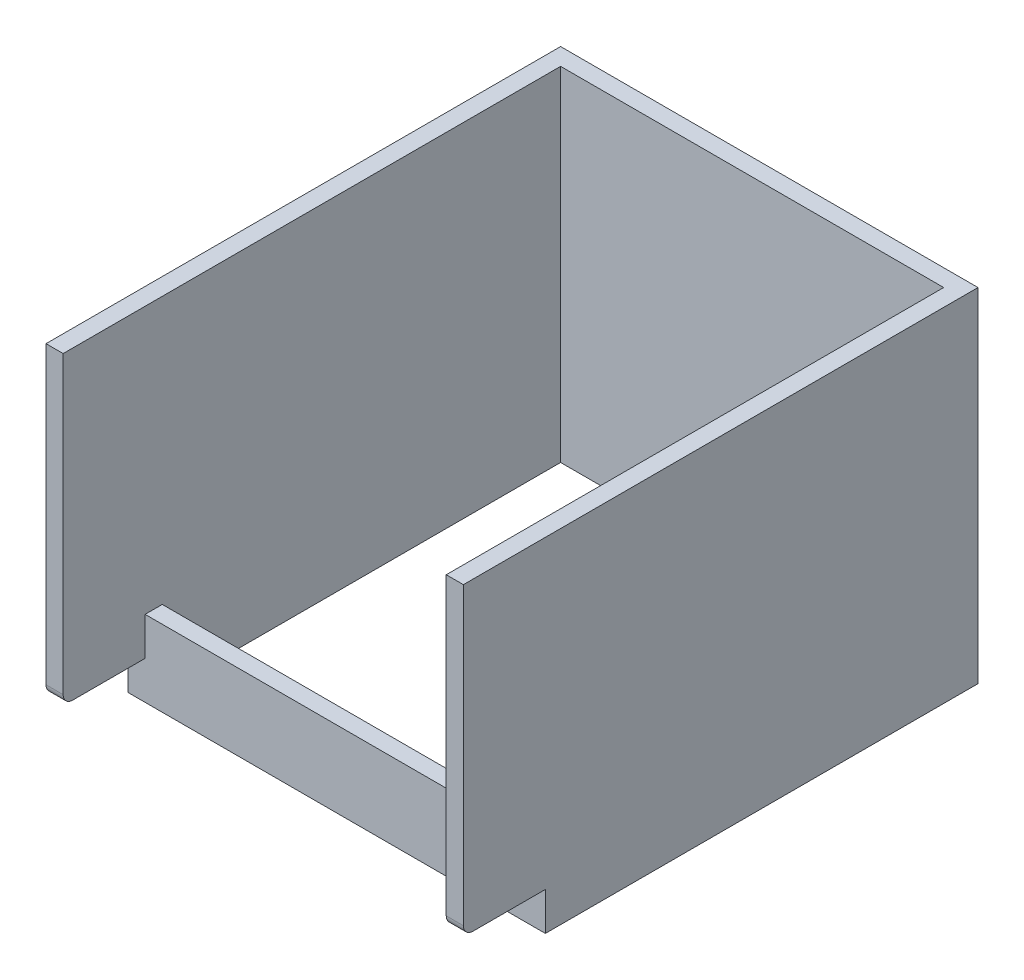
from build123d import *

# Parameters (mm, degrees)
SKETCH1_W               = 219
SKETCH1_H               = 250
BOSS_EXTRUDE1_DEPTH     = 3
EXTRUDE_THIN1_DEPTH     = 180
CUT_EXTRUDE2_DEPTH      = 256.764051422
CUT_EXTRUDE2_DEPTH_BACK = 256.764051422
SKETCH4_W               = 65.933085688
SKETCH4_H               = 20
SKETCH7_W               = 201
SKETCH7_H               = 9
BOSS_EXTRUDE3_DEPTH     = 40
FILLET7_R               = 5
SKETCH8_W               = 201
SKETCH8_H               = 209
CUT_EXTRUDE3_DEPTH      = 20


with BuildPart() as part:
    # Sketch1 → Boss-Extrude1 (new body)
    with BuildSketch(Plane(origin=(0, 0, 0), x_dir=(1, 0, 0), z_dir=(0, 1, 0))):
        Rectangle(SKETCH1_W, SKETCH1_H)
    extrude(amount=BOSS_EXTRUDE1_DEPTH)

    # Sketch2 → Extrude-Thin1 (add)
    with BuildSketch(Plane(origin=(0, 0, 0), x_dir=(1, 0, 0), z_dir=(0, 1, 0))):
        Polygon((-109.5, -145), (-109.5, -125), (-109.5, 125), (109.5, 125), (109.5, -125), (109.5, -145), (100.5, -145), (100.5, -125), (100.5, 116), (-100.5, 116), (-100.5, -125), (-100.5, -145), align=None)
    extrude(amount=EXTRUDE_THIN1_DEPTH)

    # Sketch4 → Cut-Extrude2 (cut, two sides: drawn at the far end of the back side and taken through both)
    with BuildSketch(Plane(origin=(0, 0, 0), x_dir=(0, 0, -1), z_dir=(1, 0, 0)).offset(-CUT_EXTRUDE2_DEPTH_BACK)):
        with Locations((-134.966542844, 10)):
            Rectangle(SKETCH4_W, SKETCH4_H)
    extrude(amount=CUT_EXTRUDE2_DEPTH + CUT_EXTRUDE2_DEPTH_BACK, mode=Mode.SUBTRACT)

    # Sketch7 → Boss-Extrude3 (add)
    with BuildSketch(Plane(origin=(0, 0, 0), x_dir=(1, 0, 0), z_dir=(0, 1, 0))):
        with Locations((0, -97.5)):
            Rectangle(SKETCH7_W, SKETCH7_H)
    extrude(amount=BOSS_EXTRUDE3_DEPTH)

    # Fillet7
    fillet7_edges = [part.edges().sort_by_distance(p)[0] for p in [
        (-105, 20, 145),
        (105, 20, 145),
    ]]
    fillet(fillet7_edges, radius=FILLET7_R)

    # Sketch8 → Cut-Extrude3 (cut)
    with BuildSketch(Plane(origin=(0, 0, 0), x_dir=(1, 0, 0), z_dir=(0, 1, 0))):
        with Locations((0, 11.5)):
            Rectangle(SKETCH8_W, SKETCH8_H)
    extrude(amount=CUT_EXTRUDE3_DEPTH, mode=Mode.SUBTRACT)


solid = part.part
